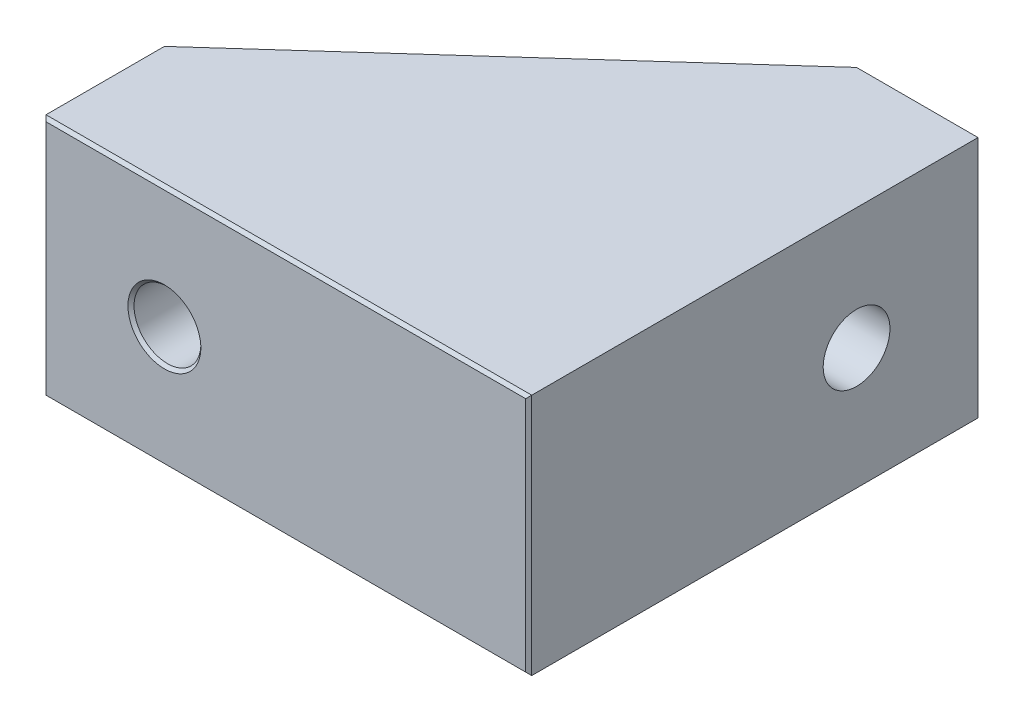
from build123d import *

# Parameters (mm, degrees)
BOSS_EXTRUDE1_DEPTH = 20
SKETCH2_R           = 2.75
CUT_EXTRUDE1_DEPTH  = 20
SKETCH3_R           = 2.75
CUT_EXTRUDE2_DEPTH  = 20
BOSS_EXTRUDE2_DEPTH = 4.5
BOSS_EXTRUDE3_DEPTH = 4.5
CHAMFER1_SIZE       = 0.25


with BuildPart() as part:
    # Sketch1 → Boss-Extrude1 (new body)
    with BuildSketch(Plane(origin=(0, 0, 0), x_dir=(1, 0, 0), z_dir=(0, 1, 0))):
        Polygon((0, 37), (-10, 37), (-10, 10), (-40, 10), (-40, 0), (0, 0), align=None)
    extrude(amount=BOSS_EXTRUDE1_DEPTH)

    # Sketch2 → Cut-Extrude1 (cut)
    with BuildSketch(Plane.ZY.offset(10)):
        with Locations((-27, 10)):
            Circle(SKETCH2_R)
    extrude(amount=-CUT_EXTRUDE1_DEPTH, mode=Mode.SUBTRACT)

    # Sketch3 → Cut-Extrude2 (cut)
    with BuildSketch(Plane(origin=(0, 0, -10), x_dir=(-1, 0, 0), z_dir=(0, 0, -1))):
        with Locations((30, 10)):
            Circle(SKETCH3_R)
    extrude(amount=-CUT_EXTRUDE2_DEPTH, mode=Mode.SUBTRACT)

    # Sketch4 → Boss-Extrude2 (add)
    with BuildSketch(Plane.XZ):
        Polygon((-40, -10), (-10, -10), (-10, -37), align=None)
    extrude(amount=-BOSS_EXTRUDE2_DEPTH)

    # Sketch5 → Boss-Extrude3 (add)
    with BuildSketch(Plane(origin=(0, 20, 0), x_dir=(1, 0, 0), z_dir=(0, 1, 0))):
        Polygon((-40, 10), (-10, 10), (-10, 37), align=None)
    extrude(amount=-BOSS_EXTRUDE3_DEPTH)

    # Chamfer1
    chamfer1_edges = [part.edges().sort_by_distance(p)[0] for p in [
        (0, 10, 0),
        (-40, 10, 0),
        (-10, 10, -29.75),
        (-20, 20, 0),
        (-27.25, 10, 0),
        (-27.25, 10, -10),
        (-20, 0, 0),
    ]]
    chamfer(chamfer1_edges, length=CHAMFER1_SIZE)


solid = part.part
